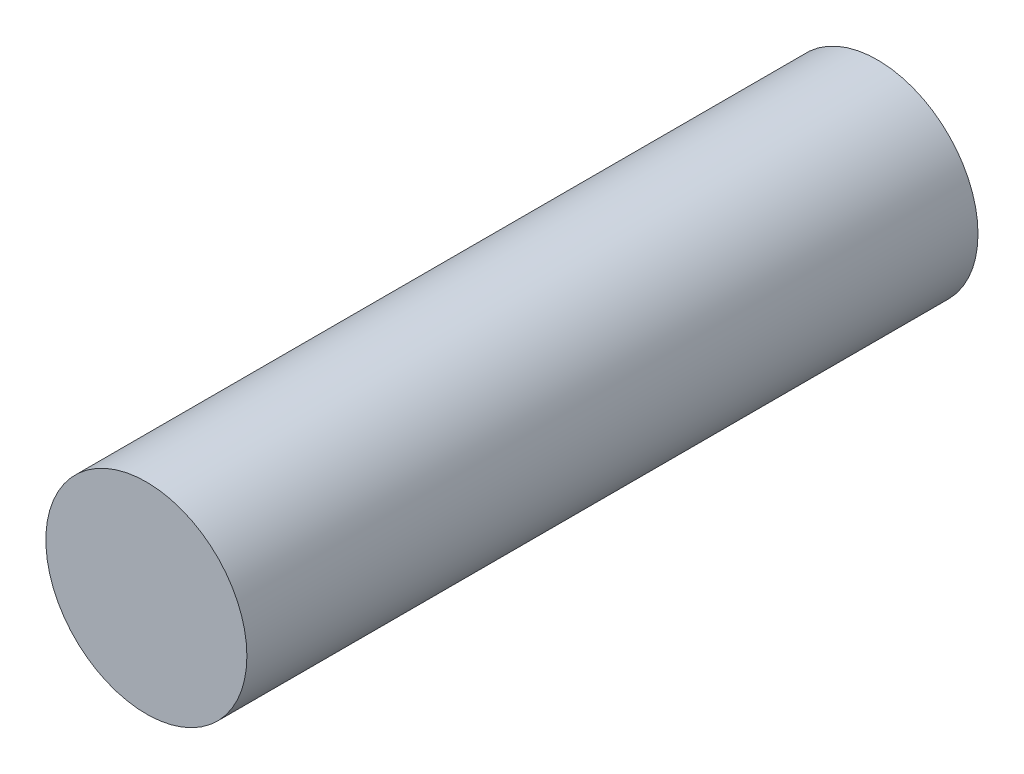
from build123d import *

# Parameters (mm, degrees)
SKETCH1_R           = 69.85
BOSS_EXTRUDE1_DEPTH = 508


with BuildPart() as part:
    # Sketch1 → Boss-Extrude1 (new body)
    with BuildSketch(Plane.XY):
        Circle(SKETCH1_R)
    extrude(amount=BOSS_EXTRUDE1_DEPTH)


solid = part.part
